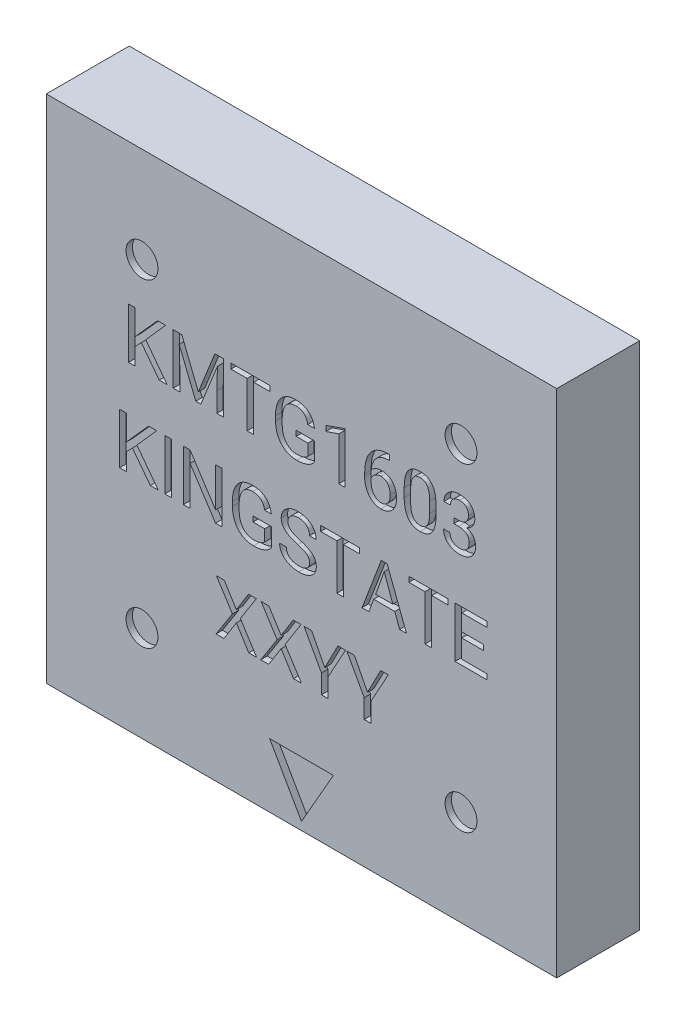
from build123d import *

# Parameters (mm, degrees)
ESQUISSE1_W             = 16
ESQUISSE1_H             = 16
BOSS_EXTRU_1_DEPTH      = 2.6
ESQUISSE2_R             = 0.5
ENL_V_MAT_EXTRU_1_DEPTH = 0.2
ESQUISSE3_W             = 0.208745941
ESQUISSE3_H             = 1.5875
ENL_V_MAT_EXTRU_2_DEPTH = 0.2


with BuildPart() as part:
    # Esquisse1 → Boss.-Extru.1 (new body)
    with BuildSketch(Plane.XY):
        with Locations((8, -8)):
            Rectangle(ESQUISSE1_W, ESQUISSE1_H)
    extrude(amount=BOSS_EXTRU_1_DEPTH)

    # Esquisse2 → Enlèv. mat.-Extru.1 (cut)
    with BuildSketch(Plane.XY.offset(2.6)):
        with Locations((3, -3)):
            Circle(ESQUISSE2_R)
        with Locations((13, -3)):
            Circle(ESQUISSE2_R)
        with Locations((13, -13)):
            Circle(ESQUISSE2_R)
        with Locations((3, -13)):
            Circle(ESQUISSE2_R)
        Polygon((7.999189106, -15.75), (8.999189106, -14), (6.999189106, -14), align=None)
    extrude(amount=-ENL_V_MAT_EXTRU_1_DEPTH, mode=Mode.SUBTRACT)

    # Esquisse3 → Enlèv. mat.-Extru.2 (cut)
    # profile 1 of 21: a face of its own
    with BuildSketch(Plane.XY.offset(2.6)):
        Polygon((13.707010958, -8.257792208), (13.020855317, -8.257792208), (13.020855317, -8.835064935), (13.817826705, -8.835064935), (13.817826705, -9), (12.812109375, -9), (12.812109375, -7.4125), (13.807196124, -7.4125), (13.807196124, -7.577435065), (13.020855317, -7.577435065), (13.020855317, -8.092857143), (13.707010958, -8.092857143), align=None)
    # profile 2 of 21: a face of its own
    with BuildSketch(Plane.XY.offset(2.6)):
        Polygon((12.586612216, -7.577435065), (12.077632914, -7.577435065), (12.077632914, -9), (11.870175528, -9), (11.870175528, -7.577435065), (11.362162642, -7.577435065), (11.362162642, -7.4125), (12.586612216, -7.4125), align=None)
    # profile 3 of 21: a face of its own
    with BuildSketch(Plane.XY.offset(2.6)):
        Polygon((10.923731737, -8.587662338), (10.26044795, -8.587662338), (10.111619825, -9), (9.896431108, -9), (10.500763494, -7.4125), (10.683416193, -7.4125), (11.289037135, -9), (11.074814834, -9), align=None)
        Polygon((10.323587155, -8.422727273), (10.861881088, -8.422727273), (10.592250913, -7.670855317), align=None, mode=Mode.SUBTRACT)
    # profile 4 of 21: a face of its own
    with BuildSketch(Plane.XY.offset(2.6)):
        Polygon((9.823949878, -7.577435065), (9.314970576, -7.577435065), (9.314970576, -9), (9.10751319, -9), (9.10751319, -7.577435065), (8.599500304, -7.577435065), (8.599500304, -7.4125), (9.823949878, -7.4125), align=None)
    # profile 5 of 21: a face of its own
    with BuildSketch(Plane.XY.offset(2.6)):
        with BuildLine():
            add(Edge.make_bspline(
                [(7.876298701, -8.292261059), (7.854664188, -8.285764441), (7.812667469, -8.273153264), (7.752394587, -8.252153704), (7.696522499, -8.230357716), (7.645210961, -8.207362912), (7.598786897, -8.182593141), (7.55634426, -8.15782518), (7.518756833, -8.131282961), (7.485663476, -8.10348242), (7.456677033, -8.074324278), (7.431654956, -8.043451028), (7.410314554, -8.011048295), (7.39312072, -7.976714466), (7.379438017, -7.941052827), (7.370238488, -7.903480864), (7.364174033, -7.864443608), (7.36348261, -7.837746624), (7.363131595, -7.824193385)],
                knots=[0, 0, 0, 0, 1.442946769, 2.801035059, 4.076184517, 5.27352813, 6.39049285, 7.436375565, 8.410868717, 9.326094427, 10.194380871, 11.033255188, 11.860919352, 12.667768038, 13.481903433, 14.295489527, 15.134672321, 16, 16, 16, 16], degree=3))
            add(Edge.make_bspline(
                [(7.363131595, -7.824193385), (7.363520425, -7.808915621), (7.364286039, -7.778833399), (7.371656998, -7.734872715), (7.383230134, -7.692781547), (7.399763394, -7.652813906), (7.420756824, -7.614728787), (7.447024325, -7.579177917), (7.477274528, -7.545117769), (7.512400911, -7.513874246), (7.550964068, -7.485262708), (7.592554786, -7.459913869), (7.637425385, -7.439111937), (7.684744901, -7.421532229), (7.735098648, -7.408512672), (7.788048779, -7.398812217), (7.843845708, -7.392946394), (7.881975732, -7.39224228), (7.901425528, -7.391883117)],
                knots=[0, 0, 0, 0, 0.949123394, 1.868842894, 2.762934863, 3.658023202, 4.551541756, 5.459557031, 6.400379858, 7.378911715, 8.376299658, 9.382673259, 10.401021107, 11.446491644, 12.51683851, 13.629846909, 14.791005431, 16, 16, 16, 16], degree=3))
            add(Edge.make_bspline(
                [(7.901425528, -7.391883117), (7.927889211, -7.392561824), (7.979702015, -7.393890654), (8.055022016, -7.406148837), (8.12604863, -7.425690985), (8.191961825, -7.453437128), (8.252252064, -7.487790377), (8.306198473, -7.528276787), (8.352560816, -7.575352565), (8.391264735, -7.627946759), (8.42181642, -7.684755658), (8.444520961, -7.74441657), (8.45762521, -7.807090152), (8.459426023, -7.849690795), (8.460336343, -7.871225649)],
                knots=[0, 0, 0, 0, 1.157874431, 2.266982995, 3.331214249, 4.376333927, 5.389203378, 6.362366569, 7.319777149, 8.271341015, 9.211596087, 10.135441968, 11.0574559, 12, 12, 12, 12], degree=3))
            Line((8.460336343, -7.871225649), (8.250301847, -7.871225649))
            add(Edge.make_bspline(
                [(8.250301847, -7.871225649), (8.25013752, -7.859287408), (8.249817941, -7.836070216), (8.244926648, -7.802271308), (8.238152705, -7.770357924), (8.227950983, -7.740386084), (8.215227158, -7.712281919), (8.199176318, -7.686408029), (8.180774871, -7.662179769), (8.159088321, -7.640521971), (8.135214645, -7.620612258), (8.108631548, -7.603581149), (8.079796504, -7.589065642), (8.048673769, -7.576960198), (8.014986816, -7.56825836), (7.979195387, -7.561310889), (7.941022059, -7.557541606), (7.91485544, -7.557063545), (7.901425528, -7.556818182)],
                knots=[0, 0, 0, 0, 1.07482023, 2.090283341, 3.071654291, 4.011100091, 4.937699537, 5.845513922, 6.749400147, 7.673165639, 8.601178817, 9.545991787, 10.511053924, 11.506634652, 12.548856192, 13.642033026, 14.789782837, 16, 16, 16, 16], degree=3))
            add(Edge.make_bspline(
                [(7.901425528, -7.556818182), (7.888957318, -7.55692659), (7.864610809, -7.557138278), (7.829145388, -7.56103031), (7.795639797, -7.566045772), (7.764424744, -7.574490323), (7.735173227, -7.58414071), (7.708024515, -7.596506993), (7.683270817, -7.611475406), (7.660329177, -7.628075283), (7.639887044, -7.646782501), (7.62232205, -7.667630546), (7.607632067, -7.690238188), (7.594966847, -7.714351696), (7.585919164, -7.740483635), (7.579060763, -7.768179963), (7.574735378, -7.797642421), (7.574337088, -7.817950179), (7.574132508, -7.828381189)],
                knots=[0, 0, 0, 0, 1.241716152, 2.424682862, 3.552343531, 4.613889406, 5.642621132, 6.619453051, 7.579256212, 8.520993708, 9.437340774, 10.333406993, 11.229728757, 12.119897209, 13.040545374, 13.977467637, 14.961133287, 16, 16, 16, 16], degree=3))
            add(Edge.make_bspline(
                [(7.574132508, -7.828381189), (7.57437111, -7.836772495), (7.574841749, -7.853324267), (7.578849992, -7.877632495), (7.585210005, -7.900902316), (7.594430418, -7.923124191), (7.606107257, -7.944305001), (7.619874274, -7.964900954), (7.637042844, -7.983864292), (7.656355746, -8.002393208), (7.679064217, -8.02001486), (7.705186047, -8.036853564), (7.734702344, -8.053740129), (7.767830124, -8.070101196), (7.804775657, -8.085670068), (7.84501245, -8.101675558), (7.88909551, -8.116555713), (7.935759516, -8.130957258), (7.982832146, -8.145305653), (8.0282287, -8.160016424), (8.07087218, -8.17517422), (8.110761379, -8.190706813), (8.148160631, -8.205988277), (8.182748474, -8.221821387), (8.214594473, -8.23796018), (8.253063519, -8.258897325), (8.296086213, -8.286670743), (8.341467107, -8.323182025), (8.379482427, -8.362689736), (8.41070326, -8.404977551), (8.434647662, -8.450831891), (8.451209792, -8.500316344), (8.462061902, -8.553475081), (8.463049343, -8.590290857), (8.463557731, -8.609245637)],
                knots=[0, 0, 0, 0, 0.628745275, 1.240194059, 1.841759006, 2.4337678, 3.038984486, 3.653024503, 4.286135225, 4.952364021, 5.657715509, 6.436970535, 7.280712884, 8.205967425, 9.2048809, 10.28571615, 11.45169818, 12.691673175, 13.947023137, 15.140987995, 16.268972542, 17.339384487, 18.350004568, 19.297407454, 20.190260585, 21.026131742, 22.580248655, 24.022346325, 25.38312576, 26.67931735, 27.95036621, 29.243629624, 30.580869372, 32, 32, 32, 32], degree=3))
            add(Edge.make_bspline(
                [(8.463557731, -8.609245637), (8.463156636, -8.624412588), (8.462366927, -8.654274551), (8.455184324, -8.697894374), (8.443118633, -8.738985544), (8.42698493, -8.778010111), (8.405550341, -8.814375199), (8.379515794, -8.848574096), (8.348639584, -8.880173238), (8.313527331, -8.909361658), (8.274648065, -8.935922953), (8.231826189, -8.958211392), (8.186327576, -8.977682556), (8.137603746, -8.993517088), (8.085753144, -9.005652707), (8.030714932, -9.014155333), (7.972633877, -9.019936268), (7.932795199, -9.020386264), (7.912378247, -9.020616883)],
                knots=[0, 0, 0, 0, 0.942848476, 1.856358972, 2.739809959, 3.601872524, 4.47585665, 5.357462874, 6.269018184, 7.217338511, 8.193540532, 9.19141121, 10.214813886, 11.268707198, 12.373513087, 13.523113076, 14.730618449, 16, 16, 16, 16], degree=3))
            add(Edge.make_bspline(
                [(7.912378247, -9.020616883), (7.88559255, -9.019929261), (7.832608392, -9.018569092), (7.754716383, -9.006066018), (7.679380723, -8.986893569), (7.619276992, -8.964151168), (7.573686158, -8.942136578), (7.541293264, -8.924493343), (7.511050184, -8.905078809), (7.482648307, -8.884562014), (7.456363102, -8.862510026), (7.432114474, -8.838948685), (7.40993491, -8.813771499), (7.389567832, -8.787388454), (7.37148582, -8.759748871), (7.356153755, -8.730959252), (7.342578783, -8.701516644), (7.332329956, -8.670823919), (7.323191478, -8.639574749), (7.317693926, -8.607141851), (7.313972057, -8.573897371), (7.313459436, -8.55137879), (7.313200081, -8.539985795)],
                knots=[0, 0, 0, 0, 1.875437348, 3.709758582, 5.512552917, 7.31498618, 8.199939646, 9.058534596, 9.897491826, 10.716098565, 11.511740121, 12.299122756, 13.082578091, 13.860523725, 14.632590546, 15.39332156, 16.144205357, 16.900795953, 17.658283692, 18.422688591, 19.201978989, 20, 20, 20, 20], degree=3))
            Line((7.313200081, -8.539985795), (7.522912439, -8.539985795))
            add(Edge.make_bspline(
                [(7.522912439, -8.539985795), (7.523157835, -8.551929628), (7.52363562, -8.575184267), (7.52921868, -8.609001366), (7.536901902, -8.641013685), (7.548733722, -8.671075001), (7.564007143, -8.699022076), (7.581973236, -8.725503503), (7.604015869, -8.74936611), (7.628730044, -8.771604538), (7.656351668, -8.791533013), (7.686500576, -8.808525055), (7.71867546, -8.823234439), (7.753140375, -8.834985639), (7.789857593, -8.844407472), (7.828737491, -8.851109017), (7.869884222, -8.854971926), (7.8979811, -8.855441304), (7.912378247, -8.855681818)],
                knots=[0, 0, 0, 0, 1.013608767, 1.9734961, 2.904960116, 3.806182834, 4.708236215, 5.606545564, 6.517183783, 7.460367022, 8.42750932, 9.403985449, 10.396018541, 11.428821219, 12.493053148, 13.613359221, 14.777059221, 16, 16, 16, 16], degree=3))
            add(Edge.make_bspline(
                [(7.912378247, -8.855681818), (7.925806864, -8.855529543), (7.951846861, -8.855234261), (7.98963354, -8.852016572), (8.024902528, -8.846473455), (8.057923638, -8.839229469), (8.08849635, -8.829531206), (8.116759104, -8.81804196), (8.142463786, -8.80407898), (8.165549768, -8.787936566), (8.186474761, -8.770303188), (8.20411004, -8.75043886), (8.21949486, -8.729377474), (8.232067304, -8.706783593), (8.241963431, -8.682590707), (8.248493053, -8.656760117), (8.252837643, -8.629481653), (8.253905288, -8.601185794), (8.252716357, -8.572943393), (8.248986767, -8.545806846), (8.242300008, -8.52042682), (8.233939066, -8.496394897), (8.221968794, -8.47447377), (8.208275615, -8.453783079), (8.191075777, -8.435548258), (8.171838585, -8.417938875), (8.148704841, -8.40194782), (8.122201368, -8.385597637), (8.09116706, -8.370173014), (8.056281416, -8.354298087), (8.017231253, -8.338596351), (7.97401848, -8.322884473), (7.92670173, -8.307013093), (7.893515176, -8.297300003), (7.876298701, -8.292261059)],
                knots=[0, 0, 0, 0, 1.274731676, 2.47188592, 3.596566026, 4.662556682, 5.678218161, 6.638111757, 7.55508779, 8.448758248, 9.309066754, 10.146416499, 10.964173464, 11.781103867, 12.595166608, 13.438391695, 14.304959699, 15.213223308, 16.121486918, 16.98655437, 17.807482669, 18.610554914, 19.394967543, 20.172593202, 20.959189078, 21.767743109, 22.64474309, 23.623879884, 24.722710417, 25.931786394, 27.26268204, 28.717272089, 30.296990951, 32, 32, 32, 32], degree=3))
        make_face()
    # profile 6 of 21: a face of its own
    with BuildSketch(Plane.XY.offset(2.6)):
        with BuildLine():
            add(Edge.make_bspline(
                [(7.053878348, -8.792864752), (7.046925424, -8.802206163), (7.033112192, -8.820764551), (7.009972632, -8.846747918), (6.984884617, -8.870878589), (6.957612078, -8.893253997), (6.928374003, -8.913718974), (6.897265326, -8.93264864), (6.863955642, -8.94923932), (6.816678815, -8.969681953), (6.753110705, -8.990384198), (6.671842677, -9.007946713), (6.584704725, -9.018750127), (6.524636491, -9.019982006), (6.493678977, -9.020616883)],
                knots=[0, 0, 0, 0, 0.666654671, 1.324429164, 1.989863089, 2.658358843, 3.342511047, 4.032250957, 4.741800952, 5.471763421, 6.980829298, 8.560994629, 10.227631307, 12, 12, 12, 12], degree=3))
            add(Edge.make_bspline(
                [(6.493678977, -9.020616883), (6.477773769, -9.020435953), (6.446325933, -9.020078217), (6.39998591, -9.015231468), (6.354958779, -9.008358894), (6.311348255, -8.998122883), (6.268762207, -8.985884856), (6.227875545, -8.969876326), (6.188249469, -8.951419779), (6.150094621, -8.930289104), (6.11358265, -8.906397584), (6.079172499, -8.879969887), (6.046704043, -8.851273131), (6.016945615, -8.819801156), (5.988468783, -8.786617637), (5.962953891, -8.750336868), (5.938988331, -8.712044916), (5.917424227, -8.671323787), (5.89815892, -8.628611185), (5.881400095, -8.584059043), (5.867199432, -8.537905558), (5.855667446, -8.490000643), (5.846313244, -8.440557724), (5.839545401, -8.389370269), (5.835379871, -8.336566816), (5.83442349, -8.300751194), (5.833938718, -8.282596895)],
                knots=[0, 0, 0, 0, 1.028468929, 2.033492539, 3.011086082, 3.973281138, 4.929413913, 5.875016411, 6.810434431, 7.755705169, 8.694007586, 9.630456767, 10.560390541, 11.493872063, 12.430450059, 13.3865576, 14.359995993, 15.351314258, 16.364872086, 17.389298017, 18.428618414, 19.486689614, 20.575265115, 21.682476393, 22.825288721, 24, 24, 24, 24], degree=3))
            Line((5.833938718, -8.282596895), (5.833938718, -8.144077212))
            add(Edge.make_bspline(
                [(5.833938718, -8.144077212), (5.834414726, -8.115067795), (5.835342085, -8.058551587), (5.843067802, -7.976274519), (5.856165808, -7.899044428), (5.874536398, -7.826979644), (5.897626772, -7.759772322), (5.926248097, -7.697576182), (5.960725814, -7.640686054), (5.999508487, -7.588506838), (6.043639644, -7.542380059), (6.091722848, -7.501599945), (6.144669822, -7.46781521), (6.201546123, -7.439750416), (6.262704569, -7.418321819), (6.327982244, -7.402733339), (6.397541565, -7.393801439), (6.445332791, -7.392533388), (6.469840706, -7.391883117)],
                knots=[0, 0, 0, 0, 1.245690805, 2.426857442, 3.545141131, 4.606601346, 5.617309566, 6.593247571, 7.540735981, 8.469521899, 9.379606562, 10.276521279, 11.170681222, 12.069904848, 12.994651948, 13.947657224, 14.947533923, 16, 16, 16, 16], degree=3))
            add(Edge.make_bspline(
                [(6.469840706, -7.391883117), (6.490047147, -7.392192996), (6.529484109, -7.392797789), (6.587040042, -7.399293333), (6.641727524, -7.408650962), (6.693420548, -7.422459876), (6.741988923, -7.440648954), (6.787585098, -7.462495087), (6.830066412, -7.488459849), (6.869401184, -7.518173162), (6.905682362, -7.551292379), (6.937918315, -7.588329841), (6.966775204, -7.628355797), (6.991683579, -7.671919156), (7.012887302, -7.718773138), (7.03064639, -7.768853187), (7.044555119, -7.822228714), (7.050726965, -7.859142272), (7.053878348, -7.877990564)],
                knots=[0, 0, 0, 0, 1.152830591, 2.249982381, 3.301969253, 4.317398906, 5.2987213, 6.258152708, 7.19892266, 8.135430506, 9.068019346, 9.997440875, 10.932925336, 11.880141718, 12.856571332, 13.864593802, 14.909648377, 16, 16, 16, 16], degree=3))
            Line((7.053878348, -7.877990564), (6.845132407, -7.877990564))
            add(Edge.make_bspline(
                [(6.845132407, -7.877990564), (6.842505728, -7.864960654), (6.837386466, -7.839566033), (6.827133463, -7.802995937), (6.81443383, -7.769199993), (6.800350269, -7.737588189), (6.783900828, -7.708607987), (6.765497605, -7.682056028), (6.745140767, -7.657945088), (6.722492087, -7.636770503), (6.698070898, -7.617795426), (6.671623536, -7.601387877), (6.643046615, -7.587401522), (6.612446916, -7.576277872), (6.579916579, -7.567434927), (6.545386309, -7.561559178), (6.508915981, -7.557484751), (6.483919328, -7.557043802), (6.471129261, -7.556818182)],
                knots=[0, 0, 0, 0, 1.170358766, 2.280968624, 3.340185272, 4.347428616, 5.325666185, 6.270042455, 7.189079754, 8.098875347, 8.995452869, 9.908633258, 10.834843072, 11.79224454, 12.771761091, 13.799439198, 14.874036465, 16, 16, 16, 16], degree=3))
            add(Edge.make_bspline(
                [(6.471129261, -7.556818182), (6.454133822, -7.557188315), (6.421059453, -7.557908621), (6.373046119, -7.565321929), (6.32805276, -7.576572579), (6.286403385, -7.593336599), (6.24783675, -7.614173134), (6.212611435, -7.640064707), (6.180489994, -7.670517325), (6.151918422, -7.705906191), (6.12630462, -7.745360713), (6.104493005, -7.789231466), (6.085729235, -7.837060308), (6.070771866, -7.889203923), (6.058891244, -7.945405416), (6.050364121, -8.005783062), (6.044723698, -8.070309102), (6.044015668, -8.11475007), (6.043651075, -8.137634436)],
                knots=[0, 0, 0, 0, 0.996403845, 1.939074856, 2.843692885, 3.711768994, 4.566040913, 5.409064383, 6.269147664, 7.155705415, 8.071400456, 9.023727466, 10.02519745, 11.081862563, 12.202603029, 13.392952397, 14.657530761, 16, 16, 16, 16], degree=3))
            Line((6.043651075, -8.137634436), (6.043651075, -8.268422788))
            add(Edge.make_bspline(
                [(6.043651075, -8.268422788), (6.043990023, -8.29034377), (6.044650895, -8.333084719), (6.050712852, -8.395361396), (6.059663629, -8.454251406), (6.073439539, -8.509526332), (6.090356281, -8.56166712), (6.111276153, -8.610298998), (6.135872126, -8.655634904), (6.164497067, -8.697004744), (6.196199702, -8.734386314), (6.230826145, -8.766923379), (6.268357947, -8.794230978), (6.308356667, -8.816955639), (6.351237481, -8.83447147), (6.39681416, -8.846638127), (6.444998131, -8.854213579), (6.478080504, -8.855185631), (6.494967532, -8.855681818)],
                knots=[0, 0, 0, 0, 1.262357278, 2.461310654, 3.601245863, 4.690377131, 5.738789585, 6.755635726, 7.735521074, 8.70490591, 9.648187167, 10.554061351, 11.434925716, 12.315681491, 13.197826198, 14.095107267, 15.027639982, 16, 16, 16, 16], degree=3))
            add(Edge.make_bspline(
                [(6.494967532, -8.855681818), (6.513881638, -8.855434714), (6.550603706, -8.854954956), (6.603833587, -8.849483458), (6.653571926, -8.841818435), (6.699657594, -8.830193294), (6.742263487, -8.814979176), (6.780928546, -8.794683371), (6.816266724, -8.770439563), (6.836185044, -8.750353431), (6.846098823, -8.740356128)],
                knots=[0, 0, 0, 0, 1.192715086, 2.315677259, 3.372538739, 4.364886101, 5.309982406, 6.218943771, 7.113529779, 8, 8, 8, 8], degree=3))
            Line((6.846098823, -8.740356128), (6.846098823, -8.381493506))
            Line((6.846098823, -8.381493506), (6.479827009, -8.381493506))
            Line((6.479827009, -8.381493506), (6.479827009, -8.216558442))
            Line((6.479827009, -8.216558442), (7.053878348, -8.216558442))
            Line((7.053878348, -8.216558442), (7.053878348, -8.792864752))
        make_face()
    # profile 7 of 21: a face of its own
    with BuildSketch(Plane.XY.offset(2.6)):
        Polygon((5.51405489, -9), (5.304342532, -9), (4.507371144, -7.776516843), (4.507371144, -9), (4.297336648, -9), (4.297336648, -7.4125), (4.507371144, -7.4125), (5.306275365, -8.641137378), (5.306275365, -7.4125), (5.51405489, -7.4125), align=None)
    # profile 8 of 21: a face of its own
    with BuildSketch(Plane.XY.offset(2.6)):
        with Locations((3.819282671, -8.20625)):
            Rectangle(ESQUISSE3_W, ESQUISSE3_H)
    # profile 9 of 21: a face of its own
    with BuildSketch(Plane.XY.offset(2.6)):
        Polygon((2.699850345, -8.261980012), (2.506244927, -8.4636389), (2.506244927, -9), (2.297498985, -9), (2.297498985, -7.4125), (2.506244927, -7.4125), (2.506244927, -8.197552252), (3.209796063, -7.4125), (3.462030743, -7.4125), (2.839014306, -8.113474026), (3.51099584, -9), (3.261016132, -9), align=None)
    # profile 10 of 21: a face of its own
    with BuildSketch(Plane.XY.offset(2.6)):
        Polygon((2.978178267, -5.261980012), (2.784572849, -5.4636389), (2.784572849, -6), (2.575826907, -6), (2.575826907, -4.4125), (2.784572849, -4.4125), (2.784572849, -5.197552252), (3.488123985, -4.4125), (3.740358665, -4.4125), (3.117342228, -5.113474026), (3.789323762, -6), (3.539344054, -6), align=None)
    # profile 11 of 21: a face of its own
    with BuildSketch(Plane.XY.offset(2.6)):
        Polygon((4.247405134, -4.4125), (4.765082183, -5.70782011), (5.282437094, -4.4125), (5.553355824, -4.4125), (5.553355824, -6), (5.344609882, -6), (5.344609882, -5.381815645), (5.364260349, -4.714666193), (4.844328328, -6), (4.684547484, -6), (4.165904018, -4.717887581), (4.186520901, -5.381815645), (4.186520901, -6), (3.977774959, -6), (3.977774959, -4.4125), align=None)
    # profile 12 of 21: a face of its own
    with BuildSketch(Plane.XY.offset(2.6)):
        Polygon((7.009745333, -4.577435065), (6.500766031, -4.577435065), (6.500766031, -6), (6.293308644, -6), (6.293308644, -4.577435065), (5.785295759, -4.577435065), (5.785295759, -4.4125), (7.009745333, -4.4125), align=None)
    # profile 13 of 21: a face of its own
    with BuildSketch(Plane.XY.offset(2.6)):
        with BuildLine():
            add(Edge.make_bspline(
                [(8.404284192, -5.792864752), (8.397331268, -5.802206163), (8.383518036, -5.820764551), (8.360378476, -5.846747918), (8.335290461, -5.870878589), (8.308017922, -5.893253997), (8.278779847, -5.913718974), (8.24767117, -5.93264864), (8.214361486, -5.94923932), (8.167084659, -5.969681953), (8.103516549, -5.990384198), (8.022248522, -6.007946713), (7.935110569, -6.018750127), (7.875042335, -6.019982006), (7.844084821, -6.020616883)],
                knots=[0, 0, 0, 0, 0.666654671, 1.324429164, 1.989863089, 2.658358843, 3.342511047, 4.032250957, 4.741800952, 5.471763421, 6.980829298, 8.560994629, 10.227631307, 12, 12, 12, 12], degree=3))
            add(Edge.make_bspline(
                [(7.844084821, -6.020616883), (7.828179613, -6.020435953), (7.796731778, -6.020078217), (7.750391754, -6.015231468), (7.705364623, -6.008358894), (7.661754099, -5.998122883), (7.619168051, -5.985884856), (7.57828139, -5.969876326), (7.538655313, -5.951419779), (7.500500466, -5.930289104), (7.463988494, -5.906397584), (7.429578343, -5.879969887), (7.397109887, -5.851273131), (7.36735146, -5.819801156), (7.338874627, -5.786617637), (7.313359735, -5.750336868), (7.289394175, -5.712044916), (7.267830071, -5.671323787), (7.248564764, -5.628611185), (7.231805939, -5.584059043), (7.217605276, -5.537905558), (7.206073291, -5.490000643), (7.196719088, -5.440557724), (7.189951246, -5.389370269), (7.185785715, -5.336566816), (7.184829334, -5.300751194), (7.184344562, -5.282596895)],
                knots=[0, 0, 0, 0, 1.028468929, 2.033492539, 3.011086082, 3.973281138, 4.929413913, 5.875016411, 6.810434431, 7.755705169, 8.694007586, 9.630456767, 10.560390541, 11.493872063, 12.430450059, 13.3865576, 14.359995993, 15.351314258, 16.364872086, 17.389298017, 18.428618414, 19.486689614, 20.575265115, 21.682476393, 22.825288721, 24, 24, 24, 24], degree=3))
            Line((7.184344562, -5.282596895), (7.184344562, -5.144077212))
            add(Edge.make_bspline(
                [(7.184344562, -5.144077212), (7.18482057, -5.115067795), (7.18574793, -5.058551587), (7.193473646, -4.976274519), (7.206571652, -4.899044428), (7.224942242, -4.826979644), (7.248032616, -4.759772322), (7.276653942, -4.697576182), (7.311131658, -4.640686054), (7.349914331, -4.588506838), (7.394045488, -4.542380059), (7.442128692, -4.501599945), (7.495075666, -4.46781521), (7.551951967, -4.439750416), (7.613110413, -4.418321819), (7.678388088, -4.402733339), (7.747947409, -4.393801439), (7.795738635, -4.392533388), (7.82024655, -4.391883117)],
                knots=[0, 0, 0, 0, 1.245690805, 2.426857442, 3.545141131, 4.606601346, 5.617309566, 6.593247571, 7.540735981, 8.469521899, 9.379606562, 10.276521279, 11.170681222, 12.069904848, 12.994651948, 13.947657224, 14.947533923, 16, 16, 16, 16], degree=3))
            add(Edge.make_bspline(
                [(7.82024655, -4.391883117), (7.840452991, -4.392192996), (7.879889953, -4.392797789), (7.937445887, -4.399293333), (7.992133369, -4.408650962), (8.043826392, -4.422459876), (8.092394767, -4.440648954), (8.137990943, -4.462495087), (8.180472256, -4.488459849), (8.219807028, -4.518173162), (8.256088206, -4.551292379), (8.288324159, -4.588329841), (8.317181048, -4.628355797), (8.342089423, -4.671919156), (8.363293146, -4.718773138), (8.381052235, -4.768853187), (8.394960964, -4.822228714), (8.40113281, -4.859142272), (8.404284192, -4.877990564)],
                knots=[0, 0, 0, 0, 1.152830591, 2.249982381, 3.301969253, 4.317398906, 5.2987213, 6.258152708, 7.19892266, 8.135430506, 9.068019346, 9.997440875, 10.932925336, 11.880141718, 12.856571332, 13.864593802, 14.909648377, 16, 16, 16, 16], degree=3))
            Line((8.404284192, -4.877990564), (8.195538251, -4.877990564))
            add(Edge.make_bspline(
                [(8.195538251, -4.877990564), (8.192911572, -4.864960654), (8.187792311, -4.839566033), (8.177539308, -4.802995937), (8.164839674, -4.769199993), (8.150756113, -4.737588189), (8.134306672, -4.708607987), (8.115903449, -4.682056028), (8.095546611, -4.657945088), (8.072897931, -4.636770503), (8.048476742, -4.617795426), (8.02202938, -4.601387877), (7.993452459, -4.587401522), (7.96285276, -4.576277872), (7.930322423, -4.567434927), (7.895792154, -4.561559178), (7.859321825, -4.557484751), (7.834325172, -4.557043802), (7.821535106, -4.556818182)],
                knots=[0, 0, 0, 0, 1.170358766, 2.280968624, 3.340185272, 4.347428616, 5.325666185, 6.270042455, 7.189079754, 8.098875347, 8.995452869, 9.908633258, 10.834843072, 11.79224454, 12.771761091, 13.799439198, 14.874036465, 16, 16, 16, 16], degree=3))
            add(Edge.make_bspline(
                [(7.821535106, -4.556818182), (7.804539666, -4.557188315), (7.771465297, -4.557908621), (7.723451963, -4.565321929), (7.678458604, -4.576572579), (7.636809229, -4.593336599), (7.598242594, -4.614173134), (7.563017279, -4.640064707), (7.530895838, -4.670517325), (7.502324266, -4.705906191), (7.476710464, -4.745360713), (7.45489885, -4.789231466), (7.436135079, -4.837060308), (7.42117771, -4.889203923), (7.409297088, -4.945405416), (7.400769965, -5.005783062), (7.395129542, -5.070309102), (7.394421512, -5.11475007), (7.39405692, -5.137634436)],
                knots=[0, 0, 0, 0, 0.996403845, 1.939074856, 2.843692885, 3.711768994, 4.566040913, 5.409064383, 6.269147664, 7.155705415, 8.071400456, 9.023727466, 10.02519745, 11.081862563, 12.202603029, 13.392952397, 14.657530761, 16, 16, 16, 16], degree=3))
            Line((7.39405692, -5.137634436), (7.39405692, -5.268422788))
            add(Edge.make_bspline(
                [(7.39405692, -5.268422788), (7.394395868, -5.29034377), (7.395056739, -5.333084719), (7.401118696, -5.395361396), (7.410069473, -5.454251406), (7.423845384, -5.509526332), (7.440762125, -5.56166712), (7.461681997, -5.610298998), (7.48627797, -5.655634904), (7.514902911, -5.697004744), (7.546605546, -5.734386314), (7.581231989, -5.766923379), (7.618763791, -5.794230978), (7.658762511, -5.816955639), (7.701643325, -5.83447147), (7.747220005, -5.846638127), (7.795403975, -5.854213579), (7.828486349, -5.855185631), (7.845373377, -5.855681818)],
                knots=[0, 0, 0, 0, 1.262357278, 2.461310654, 3.601245863, 4.690377131, 5.738789585, 6.755635726, 7.735521074, 8.70490591, 9.648187167, 10.554061351, 11.434925716, 12.315681491, 13.197826198, 14.095107267, 15.027639982, 16, 16, 16, 16], degree=3))
            add(Edge.make_bspline(
                [(7.845373377, -5.855681818), (7.864287482, -5.855434714), (7.901009551, -5.854954956), (7.954239431, -5.849483458), (8.00397777, -5.841818435), (8.050063438, -5.830193294), (8.092669331, -5.814979176), (8.13133439, -5.794683371), (8.166672568, -5.770439563), (8.186590888, -5.750353431), (8.196504667, -5.740356128)],
                knots=[0, 0, 0, 0, 1.192715086, 2.315677259, 3.372538739, 4.364886101, 5.309982406, 6.218943771, 7.113529779, 8, 8, 8, 8], degree=3))
            Line((8.196504667, -5.740356128), (8.196504667, -5.381493506))
            Line((8.196504667, -5.381493506), (7.830232853, -5.381493506))
            Line((7.830232853, -5.381493506), (7.830232853, -5.216558442))
            Line((7.830232853, -5.216558442), (8.404284192, -5.216558442))
            Line((8.404284192, -5.216558442), (8.404284192, -5.792864752))
        make_face()
    # profile 14 of 21: a face of its own
    with BuildSketch(Plane.XY.offset(2.6)):
        Polygon((9.369734172, -6), (9.167753145, -6), (9.167753145, -4.645084213), (8.762180398, -4.783603896), (8.762180398, -4.618668831), (9.338486709, -4.4125), (9.369734172, -4.4125), align=None)
    # profile 15 of 21: a face of its own
    with BuildSketch(Plane.XY.offset(2.6)):
        with BuildLine():
            Line((10.755897423, -4.4125), (10.755897423, -4.577435065))
            Line((10.755897423, -4.577435065), (10.718851461, -4.577435065))
            add(Edge.make_bspline(
                [(10.718851461, -4.577435065), (10.69971468, -4.578194281), (10.662376441, -4.579675607), (10.607904521, -4.587130929), (10.556493234, -4.599079831), (10.507998108, -4.615104729), (10.462562948, -4.635534481), (10.420134351, -4.660138455), (10.380509047, -4.688954188), (10.344263856, -4.722155571), (10.311219765, -4.759048782), (10.281815556, -4.799554163), (10.25598216, -4.843439474), (10.234141016, -4.890783745), (10.215599446, -4.941256396), (10.201316988, -4.995327148), (10.190236953, -5.052697989), (10.185963052, -5.092279737), (10.183778916, -5.11250761)],
                knots=[0, 0, 0, 0, 1.091157859, 2.128984682, 3.128137495, 4.095865509, 5.035489046, 5.96242903, 6.886697945, 7.822506445, 8.758755167, 9.705072438, 10.67078548, 11.656538905, 12.673067975, 13.731640343, 14.840776551, 16, 16, 16, 16], degree=3))
            add(Edge.make_bspline(
                [(10.183778916, -5.11250761), (10.194502609, -5.10110608), (10.21573586, -5.078530693), (10.251375939, -5.049004234), (10.290216579, -5.024350801), (10.331671332, -5.004030286), (10.376162007, -4.988494314), (10.423314376, -4.977264114), (10.473394546, -4.970386302), (10.507721093, -4.969571719), (10.525246043, -4.969155844)],
                knots=[0, 0, 0, 0, 0.981677236, 1.943751893, 2.895289451, 3.862753925, 4.834667611, 5.846439526, 6.900529096, 8, 8, 8, 8], degree=3))
            add(Edge.make_bspline(
                [(10.525246043, -4.969155844), (10.542020699, -4.969569278), (10.57485302, -4.970378475), (10.622790691, -4.977292076), (10.668243628, -4.988589024), (10.711142706, -5.004225438), (10.751356698, -5.02483788), (10.788707745, -5.050125607), (10.823797605, -5.079611852), (10.855834328, -5.113443587), (10.884710565, -5.150696472), (10.910067898, -5.190889621), (10.931215454, -5.233825472), (10.948805655, -5.279286584), (10.962249519, -5.327418981), (10.971870937, -5.378280834), (10.977750476, -5.431716044), (10.978457557, -5.468241117), (10.978817472, -5.486832894)],
                knots=[0, 0, 0, 0, 1.039980532, 2.035509747, 2.996582654, 3.940543103, 4.860903185, 5.791852656, 6.732400408, 7.698077284, 8.675872521, 9.651488014, 10.640311747, 11.639642954, 12.670628428, 13.73514097, 14.847154866, 16, 16, 16, 16], degree=3))
            add(Edge.make_bspline(
                [(10.978817472, -5.486832894), (10.978527049, -5.506611104), (10.977960327, -5.545205767), (10.971207551, -5.601410907), (10.961004776, -5.654662896), (10.946702621, -5.705055922), (10.927509264, -5.752201988), (10.904579849, -5.796423397), (10.87733704, -5.83753164), (10.84621764, -5.875508509), (10.811446348, -5.90950011), (10.773947701, -5.939664915), (10.732957745, -5.964260109), (10.689668255, -5.985287044), (10.643141763, -6.000851073), (10.594132044, -6.012573955), (10.542081172, -6.019390252), (10.506474492, -6.020200857), (10.488200081, -6.020616883)],
                knots=[0, 0, 0, 0, 1.160113194, 2.263813421, 3.316767604, 4.339902053, 5.332221125, 6.299000376, 7.258523217, 8.221103713, 9.174710884, 10.107690257, 11.038219043, 11.974003353, 12.9265689, 13.910912406, 14.927817905, 16, 16, 16, 16], degree=3))
            add(Edge.make_bspline(
                [(10.488200081, -6.020616883), (10.469693895, -6.020204143), (10.433341197, -6.019393376), (10.380358547, -6.010578382), (10.329851068, -5.997297882), (10.282313629, -5.977635677), (10.237156855, -5.953069708), (10.194739022, -5.92292956), (10.155252021, -5.88709541), (10.118673692, -5.846277968), (10.08577685, -5.80109275), (10.056882628, -5.752496263), (10.032655548, -5.700689897), (10.013042455, -5.645627281), (9.997677413, -5.58752944), (9.986252462, -5.526404406), (9.979917499, -5.462055719), (9.979030091, -5.418123236), (9.978576502, -5.395667614)],
                knots=[0, 0, 0, 0, 0.98196525, 1.928927253, 2.844758948, 3.750233454, 4.653694275, 5.569898774, 6.506708913, 7.47997454, 8.475786024, 9.47047009, 10.478212746, 11.508236057, 12.570636359, 13.666817008, 14.807418256, 16, 16, 16, 16], degree=3))
            Line((9.978576502, -5.395667614), (9.978576502, -5.318354302))
            add(Edge.make_bspline(
                [(9.978576502, -5.318354302), (9.97909135, -5.282899185), (9.98008994, -5.214131077), (9.988978422, -5.114170968), (10.003093545, -5.020537699), (10.023722318, -4.933413896), (10.049794775, -4.852632209), (10.081415812, -4.778131116), (10.119857412, -4.710459294), (10.163241221, -4.648670158), (10.213024247, -4.594007115), (10.268725668, -4.546499568), (10.329953693, -4.506038201), (10.39691017, -4.472653117), (10.469592413, -4.44654801), (10.548011067, -4.427724919), (10.632048065, -4.415640509), (10.690032056, -4.413565772), (10.719817877, -4.4125)],
                knots=[0, 0, 0, 0, 1.277596776, 2.478003778, 3.613754522, 4.687626462, 5.700978049, 6.670049158, 7.598905399, 8.500929788, 9.385788113, 10.255968039, 11.132911756, 12.024246098, 12.94607771, 13.910066108, 14.926420989, 16, 16, 16, 16], degree=3))
            Line((10.719817877, -4.4125), (10.755897423, -4.4125))
        make_face()
        with BuildLine():
            add(Edge.make_bspline(
                [(10.491743608, -5.134090909), (10.474812505, -5.134807729), (10.441189641, -5.136231237), (10.392021214, -5.14851797), (10.34466604, -5.167464505), (10.300728956, -5.194719669), (10.260899999, -5.227035865), (10.226641184, -5.263852184), (10.199507755, -5.305117119), (10.186874042, -5.335203613), (10.180557528, -5.350246043)],
                knots=[0, 0, 0, 0, 1.008444552, 2.002633596, 3.005224358, 4.039908368, 5.073184091, 6.056754431, 7.028429986, 8, 8, 8, 8], degree=3))
            Line((10.180557528, -5.350246043), (10.180557528, -5.423693689))
            add(Edge.make_bspline(
                [(10.180557528, -5.423693689), (10.18076247, -5.439489161), (10.181163363, -5.470387065), (10.185526358, -5.515462308), (10.192132225, -5.558236386), (10.201776195, -5.598657507), (10.214407028, -5.636752137), (10.229464302, -5.672590373), (10.2472923, -5.706062541), (10.267719554, -5.736882863), (10.290598781, -5.764323992), (10.314480238, -5.788876552), (10.340000632, -5.80968734), (10.367130312, -5.826458765), (10.39549744, -5.839494873), (10.425091427, -5.849007207), (10.456210992, -5.854514108), (10.477440885, -5.855289071), (10.488200081, -5.855681818)],
                knots=[0, 0, 0, 0, 1.283539721, 2.51076306, 3.677392053, 4.799415647, 5.884154539, 6.936271597, 7.955432841, 8.96248719, 9.935882104, 10.855510359, 11.742928931, 12.605224519, 13.441005033, 14.274640703, 15.125597116, 16, 16, 16, 16], degree=3))
            add(Edge.make_bspline(
                [(10.488200081, -5.855681818), (10.49927502, -5.855359031), (10.520875434, -5.854729472), (10.552334571, -5.850218542), (10.58196732, -5.842466929), (10.609712448, -5.831447895), (10.6357882, -5.817581689), (10.659819658, -5.800229105), (10.682071034, -5.779893077), (10.702343047, -5.756554129), (10.72062085, -5.730910629), (10.736620106, -5.703007907), (10.749481158, -5.672888863), (10.761154923, -5.641336849), (10.769229934, -5.607556522), (10.7754695, -5.572072493), (10.77894069, -5.534577889), (10.779466618, -5.508959621), (10.779735694, -5.49585278)],
                knots=[0, 0, 0, 0, 1.01911688, 1.987672023, 2.917749205, 3.831672007, 4.729258522, 5.628801512, 6.552186455, 7.497677453, 8.468448512, 9.446636265, 10.451080494, 11.479498908, 12.538931857, 13.642126426, 14.793662575, 16, 16, 16, 16], degree=3))
            add(Edge.make_bspline(
                [(10.779735694, -5.49585278), (10.77947392, -5.482637485), (10.778964295, -5.45690969), (10.775411301, -5.419215935), (10.769338389, -5.383452908), (10.760770651, -5.349554387), (10.749236736, -5.317776831), (10.735981237, -5.287699744), (10.719514806, -5.259884079), (10.701437522, -5.233732538), (10.680854235, -5.210462062), (10.658880712, -5.189698028), (10.634807714, -5.172815131), (10.609608467, -5.158121384), (10.582147385, -5.147845772), (10.553586432, -5.139488731), (10.523126841, -5.135067052), (10.502386433, -5.134421943), (10.491743608, -5.134090909)],
                knots=[0, 0, 0, 0, 1.221889355, 2.378798227, 3.496925182, 4.573365822, 5.606582527, 6.619759187, 7.607463809, 8.590867301, 9.554780489, 10.475165735, 11.378905723, 12.268074956, 13.164146708, 14.082011448, 15.015794874, 16, 16, 16, 16], degree=3))
        make_face(mode=Mode.SUBTRACT)
    # profile 16 of 21: a face of its own
    with BuildSketch(Plane.XY.offset(2.6)):
        with BuildLine():
            add(Edge.make_bspline(
                [(12.216796875, -5.322864245), (12.216409507, -5.351434568), (12.215660229, -5.406697603), (12.210389984, -5.486747553), (12.200667479, -5.561052688), (12.18761056, -5.629727362), (12.171119538, -5.693003687), (12.150131156, -5.75041047), (12.125799661, -5.802398622), (12.09729288, -5.848594236), (12.064796447, -5.889320639), (12.028287501, -5.924936415), (11.986781515, -5.954346126), (11.941314927, -5.978656221), (11.891667071, -5.997757863), (11.837793549, -6.011139163), (11.779693121, -6.019346504), (11.73952298, -6.020184143), (11.718770292, -6.020616883)],
                knots=[0, 0, 0, 0, 1.40023343, 2.708445015, 3.929118437, 5.070650633, 6.132737954, 7.130001643, 8.062197437, 8.941367129, 9.783809667, 10.610069827, 11.432297786, 12.268139301, 13.131125304, 14.032261292, 14.983427318, 16, 16, 16, 16], degree=3))
            add(Edge.make_bspline(
                [(11.718770292, -6.020616883), (11.698334152, -6.020202543), (11.658688192, -6.019398727), (11.601357996, -6.010893413), (11.547748227, -5.998554121), (11.498608189, -5.979500783), (11.453203554, -5.956084086), (11.412334907, -5.926644928), (11.375314638, -5.892329125), (11.34250322, -5.852506531), (11.313933751, -5.807474707), (11.288991976, -5.75735045), (11.267905333, -5.702058058), (11.25017178, -5.6416478), (11.236533279, -5.576009676), (11.226348631, -5.50521976), (11.219472181, -5.429298492), (11.218184785, -5.376891355), (11.217522321, -5.349923904)],
                knots=[0, 0, 0, 0, 1.02805657, 1.994422029, 2.912254547, 3.791761639, 4.640526213, 5.477606564, 6.319143947, 7.175364868, 8.067638948, 8.998434952, 9.989333135, 11.043079992, 12.164854869, 13.361348356, 14.642213427, 16, 16, 16, 16], degree=3))
            Line((11.217522321, -5.349923904), (11.217522321, -5.080938007))
            add(Edge.make_bspline(
                [(11.217522321, -5.080938007), (11.217910515, -5.052690004), (11.21866111, -4.998070911), (11.223914735, -4.918981454), (11.233699837, -4.845548342), (11.246615104, -4.777693053), (11.263357024, -4.715282082), (11.283781913, -4.658467615), (11.308199066, -4.607170682), (11.33683015, -4.561625884), (11.369085833, -4.5211027), (11.406157504, -4.486385009), (11.447525277, -4.457153152), (11.493110321, -4.433135267), (11.543000012, -4.41440879), (11.597218719, -4.401447977), (11.655481959, -4.393144601), (11.69576123, -4.392312078), (11.716515321, -4.391883117)],
                knots=[0, 0, 0, 0, 1.393495682, 2.694401802, 3.907295328, 5.045885101, 6.099565595, 7.091578124, 8.02030673, 8.89623373, 9.740051124, 10.568244803, 11.392771337, 12.231586015, 13.103274323, 14.014157231, 14.976784819, 16, 16, 16, 16], degree=3))
            add(Edge.make_bspline(
                [(11.716515321, -4.391883117), (11.737157573, -4.392341396), (11.777093342, -4.39322801), (11.834955259, -4.401088622), (11.888584528, -4.413949888), (11.938364842, -4.431399228), (11.983444897, -4.454949049), (12.024654596, -4.483181092), (12.061439851, -4.516847171), (12.094077661, -4.555773158), (12.122425218, -4.600074324), (12.147311311, -4.649604014), (12.168052173, -4.70475489), (12.185511053, -4.76526458), (12.198792364, -4.831560923), (12.208571458, -4.903324367), (12.215193732, -4.980633747), (12.216250242, -5.033998849), (12.216796875, -5.061609679)],
                knots=[0, 0, 0, 0, 1.036707429, 2.005677803, 2.926853111, 3.803974618, 4.648486318, 5.474530802, 6.30701549, 7.145578633, 8.019475601, 8.943521554, 9.925396686, 10.975451482, 12.10436541, 13.318982711, 14.612855355, 16, 16, 16, 16], degree=3))
            Line((12.216796875, -5.061609679), (12.216796875, -5.322864245))
        make_face()
        with BuildLine():
            add(Edge.make_bspline(
                [(12.015460126, -5.046791295), (12.015358743, -5.026166864), (12.015163202, -4.986387731), (12.011313036, -4.928914779), (12.006271575, -4.875732751), (11.998040597, -4.826951505), (11.988234497, -4.7823489), (11.976244806, -4.741902757), (11.961337008, -4.706075972), (11.944620357, -4.674225436), (11.925056643, -4.646667498), (11.903356689, -4.622371687), (11.878725552, -4.601933397), (11.851291974, -4.585423036), (11.821351167, -4.572292664), (11.788641725, -4.563556658), (11.753436061, -4.557873535), (11.729102439, -4.557177976), (11.716515321, -4.556818182)],
                knots=[0, 0, 0, 0, 1.517926963, 2.927684219, 4.238898001, 5.448787502, 6.566849578, 7.599612596, 8.549419051, 9.419425551, 10.241877608, 11.030983508, 11.81133014, 12.588145411, 13.381161416, 14.209669346, 15.073910809, 16, 16, 16, 16], degree=3))
            add(Edge.make_bspline(
                [(11.716515321, -4.556818182), (11.704036211, -4.557179957), (11.679917383, -4.557879174), (11.645020083, -4.563532087), (11.61271136, -4.572365595), (11.582896843, -4.585128777), (11.555601946, -4.601508513), (11.531407333, -4.622173464), (11.509436219, -4.645921397), (11.490465718, -4.673574107), (11.47398088, -4.705016806), (11.459515742, -4.740168485), (11.44752359, -4.779274982), (11.437038856, -4.822150044), (11.429243598, -4.869002505), (11.423467913, -4.919752155), (11.420003345, -4.97437173), (11.419249583, -5.012102847), (11.418859071, -5.031650771)],
                knots=[0, 0, 0, 0, 0.941965402, 1.82057074, 2.66271545, 3.46560191, 4.262527736, 5.056849829, 5.860391306, 6.699484899, 7.581041908, 8.537350148, 9.565857304, 10.667324152, 11.868550899, 13.150090833, 14.523504931, 16, 16, 16, 16], degree=3))
            Line((11.418859071, -5.031650771), (11.418859071, -5.35378957))
            add(Edge.make_bspline(
                [(11.418859071, -5.35378957), (11.41914919, -5.374517622), (11.419710246, -5.41460319), (11.422791446, -5.472662789), (11.428394849, -5.526469175), (11.436978959, -5.575979259), (11.446936999, -5.621525272), (11.459775371, -5.662801478), (11.474974418, -5.699892873), (11.492268587, -5.732921164), (11.512017682, -5.76203558), (11.534516239, -5.787078152), (11.559268445, -5.80856488), (11.586800515, -5.825672376), (11.616220491, -5.839513463), (11.648327733, -5.848643998), (11.682676735, -5.854693652), (11.706501217, -5.855345916), (11.718770292, -5.855681818)],
                knots=[0, 0, 0, 0, 1.50665053, 2.913681466, 4.224632892, 5.435887079, 6.564349371, 7.611008132, 8.573407165, 9.474177506, 10.316300961, 11.123258751, 11.914782798, 12.689976991, 13.472211437, 14.26986845, 15.109020931, 16, 16, 16, 16], degree=3))
            add(Edge.make_bspline(
                [(11.718770292, -5.855681818), (11.730814319, -5.855277333), (11.754157461, -5.854493379), (11.788052931, -5.849388012), (11.81961567, -5.840389206), (11.848654503, -5.827375327), (11.875432814, -5.811216346), (11.899612599, -5.791232256), (11.92121486, -5.767473148), (11.940691744, -5.740127734), (11.957843665, -5.70887896), (11.972482919, -5.673470352), (11.985434027, -5.634222719), (11.995539522, -5.590614742), (12.003762978, -5.543065421), (12.010356607, -5.491277419), (12.013958733, -5.435337756), (12.014948964, -5.396638261), (12.015460126, -5.376661425)],
                knots=[0, 0, 0, 0, 0.907615006, 1.759094876, 2.576076633, 3.37305625, 4.150235137, 4.926275732, 5.728088303, 6.563419022, 7.45078728, 8.408155106, 9.447100327, 10.561932391, 11.777903666, 13.082715903, 14.49408613, 16, 16, 16, 16], degree=3))
            Line((12.015460126, -5.376661425), (12.015460126, -5.046791295))
        make_face(mode=Mode.SUBTRACT)
    # profile 17 of 21: a face of its own
    with BuildSketch(Plane.XY.offset(2.6)):
        with BuildLine():
            Line((12.774096997, -5.113474026), (12.925180093, -5.113474026))
            add(Edge.make_bspline(
                [(12.925180093, -5.113474026), (12.936788331, -5.113110199), (12.959423703, -5.112400757), (12.99237866, -5.108471396), (13.023421659, -5.102420096), (13.052540531, -5.094048932), (13.079762706, -5.083444534), (13.104918087, -5.070443866), (13.128454969, -5.055657033), (13.149631511, -5.038205738), (13.168644539, -5.018802702), (13.185489127, -4.998000639), (13.199478448, -4.975311205), (13.211220684, -4.951224745), (13.219745242, -4.925143426), (13.226273024, -4.897690338), (13.230187197, -4.868545705), (13.230652034, -4.848580409), (13.230889813, -4.838367492)],
                knots=[0, 0, 0, 0, 1.200864367, 2.341614004, 3.428590173, 4.469117729, 5.471540268, 6.4451815, 7.394182585, 8.341361919, 9.276019593, 10.200591215, 11.103629179, 12.027666906, 12.965487114, 13.935383191, 14.943879401, 16, 16, 16, 16], degree=3))
            add(Edge.make_bspline(
                [(13.230889813, -4.838367492), (13.230741844, -4.826976879), (13.230455029, -4.804898008), (13.227180965, -4.772906983), (13.221830073, -4.743129638), (13.213969711, -4.715584651), (13.204442072, -4.690021857), (13.192619154, -4.66664578), (13.178012697, -4.645886716), (13.162163312, -4.62666774), (13.143485815, -4.610112403), (13.12261504, -4.595916873), (13.099816879, -4.583567207), (13.074606156, -4.574027578), (13.047484924, -4.5661757), (13.018001487, -4.560951673), (12.986485136, -4.557148036), (12.964708335, -4.556930079), (12.953528308, -4.556818182)],
                knots=[0, 0, 0, 0, 1.205200971, 2.336088131, 3.399393991, 4.403211767, 5.363627486, 6.283652907, 7.166347384, 8.045302391, 8.914578364, 9.797272842, 10.712512295, 11.651712761, 12.644597703, 13.696729519, 14.817520295, 16, 16, 16, 16], degree=3))
            add(Edge.make_bspline(
                [(12.953528308, -4.556818182), (12.942893612, -4.55712156), (12.922219351, -4.55771134), (12.891845852, -4.560685633), (12.863388186, -4.567053737), (12.836267066, -4.574866698), (12.811205666, -4.58577464), (12.78723055, -4.598146277), (12.765539519, -4.613891191), (12.745126318, -4.631089482), (12.727076745, -4.65053788), (12.711318616, -4.671542061), (12.697479762, -4.693923082), (12.686642019, -4.718127612), (12.678312306, -4.743757976), (12.672035837, -4.770784527), (12.668601113, -4.799407242), (12.668064502, -4.819030723), (12.667791193, -4.829025467)],
                knots=[0, 0, 0, 0, 1.147390074, 2.230570743, 3.284446238, 4.288269575, 5.26905072, 6.22749524, 7.191381151, 8.152271132, 9.102706813, 10.045350165, 10.980781579, 11.934386679, 12.897507077, 13.883538365, 14.922031733, 16, 16, 16, 16], degree=3))
            Line((12.667791193, -4.829025467), (12.466454444, -4.829025467))
            add(Edge.make_bspline(
                [(12.466454444, -4.829025467), (12.466895961, -4.813646981), (12.467764442, -4.783396901), (12.474361072, -4.739137824), (12.48497687, -4.696767775), (12.500140901, -4.65646714), (12.519687189, -4.618185461), (12.543211974, -4.581819698), (12.571691045, -4.547921361), (12.603644736, -4.515954323), (12.638796481, -4.486591668), (12.677178399, -4.461568329), (12.717420646, -4.439683292), (12.760338524, -4.422466065), (12.805179553, -4.408360089), (12.852590559, -4.398882065), (12.902262667, -4.392933477), (12.936222664, -4.392237685), (12.953528308, -4.391883117)],
                knots=[0, 0, 0, 0, 1.008024764, 1.982824013, 2.927143535, 3.867385949, 4.799420644, 5.740690574, 6.700758299, 7.696462765, 8.701606573, 9.69751016, 10.696048351, 11.700180637, 12.724595536, 13.774013249, 14.865661413, 16, 16, 16, 16], degree=3))
            add(Edge.make_bspline(
                [(12.953528308, -4.391883117), (12.971688993, -4.39226601), (13.007129118, -4.393013218), (13.058750146, -4.39847509), (13.107394951, -4.407732181), (13.152956808, -4.421043086), (13.195741751, -4.437608671), (13.235227015, -4.458498975), (13.271965313, -4.48258234), (13.305077998, -4.510876944), (13.335311717, -4.541944197), (13.36097344, -4.576729325), (13.383195436, -4.61393786), (13.400941682, -4.654342984), (13.414704598, -4.697563625), (13.424665751, -4.743722923), (13.430937608, -4.792665573), (13.431577434, -4.826321528), (13.431904424, -4.843521713)],
                knots=[0, 0, 0, 0, 1.168106029, 2.279529761, 3.334843901, 4.349144189, 5.329135759, 6.280770157, 7.217598711, 8.14891045, 9.077143126, 9.99998857, 10.922834015, 11.85984081, 12.831937471, 13.835906664, 14.894020291, 16, 16, 16, 16], degree=3))
            add(Edge.make_bspline(
                [(13.431904424, -4.843521713), (13.431089996, -4.860777247), (13.429449903, -4.895526399), (13.416204037, -4.946959517), (13.394893681, -4.997432042), (13.365716512, -5.04619002), (13.329681553, -5.091863853), (13.286728134, -5.131725184), (13.237722613, -5.165664397), (13.201431903, -5.182505452), (13.182891132, -5.191109476)],
                knots=[0, 0, 0, 0, 0.915149848, 1.842926455, 2.801118709, 3.815975001, 4.850543085, 5.879125129, 6.91645399, 8, 8, 8, 8], degree=3))
            add(Edge.make_bspline(
                [(13.182891132, -5.191109476), (13.193453336, -5.194760882), (13.214251318, -5.201950845), (13.244320439, -5.214415221), (13.272476117, -5.228915408), (13.298472229, -5.245452861), (13.322966044, -5.263225626), (13.345458046, -5.282879811), (13.366165585, -5.304198034), (13.384906671, -5.327161815), (13.401656208, -5.351597633), (13.416203416, -5.37747151), (13.428486621, -5.404637102), (13.438473109, -5.433096658), (13.446294793, -5.462934946), (13.451508381, -5.494106903), (13.455412889, -5.526573234), (13.455631189, -5.54867099), (13.455742695, -5.559958401)],
                knots=[0, 0, 0, 0, 1.083547811, 2.133608447, 3.153499447, 4.150164076, 5.118580075, 6.085371355, 7.042639587, 7.997242512, 8.956095064, 9.91183307, 10.871815678, 11.843305578, 12.833312241, 13.858716205, 14.906244142, 16, 16, 16, 16], degree=3))
            add(Edge.make_bspline(
                [(13.455742695, -5.559958401), (13.455295441, -5.577157691), (13.454420043, -5.610821391), (13.447995277, -5.659957152), (13.436928496, -5.706315275), (13.421951283, -5.750090894), (13.402001132, -5.790908501), (13.378202481, -5.829257016), (13.349468102, -5.864453603), (13.317111854, -5.897006944), (13.280876273, -5.925778664), (13.24220301, -5.951586712), (13.200429955, -5.972686956), (13.156209983, -5.990202863), (13.1095713, -6.004097686), (13.060151006, -6.013692565), (13.008223249, -6.01940458), (12.954490972, -6.021262892), (12.900899271, -6.019303749), (12.84892094, -6.014102059), (12.799620172, -6.004286333), (12.752816815, -5.991181386), (12.708482193, -5.974392936), (12.667006065, -5.953414395), (12.627953273, -5.928705279), (12.591823861, -5.900533156), (12.558883152, -5.869458008), (12.53029206, -5.835435586), (12.506391929, -5.79877103), (12.486633755, -5.75988935), (12.470973136, -5.71868199), (12.46013111, -5.674992822), (12.453576648, -5.628880136), (12.452719025, -5.59734851), (12.452280337, -5.581219562)],
                knots=[0, 0, 0, 0, 1.088231885, 2.129966551, 3.128731662, 4.100052983, 5.051273094, 5.997700031, 6.949599447, 7.920159917, 8.89645961, 9.872688362, 10.857299744, 11.851593804, 12.87927234, 13.932029094, 15.03283187, 16.181901815, 17.330971759, 18.424283131, 19.483707051, 20.507604696, 21.496964264, 22.478499351, 23.443669235, 24.416866361, 25.373314325, 26.304222394, 27.222043756, 28.136740867, 29.059278814, 30.005242181, 30.979648351, 32, 32, 32, 32], degree=3))
            Line((12.452280337, -5.581219562), (12.654583502, -5.581219562))
            add(Edge.make_bspline(
                [(12.654583502, -5.581219562), (12.654824179, -5.591325301), (12.655297119, -5.611183549), (12.65921424, -5.640215395), (12.665654987, -5.667591507), (12.674392369, -5.693593127), (12.685995261, -5.717823507), (12.699872372, -5.740824184), (12.71695301, -5.761640599), (12.735699212, -5.78142366), (12.757094387, -5.798666243), (12.780099275, -5.814025248), (12.805009397, -5.826813001), (12.83156845, -5.837640516), (12.860039831, -5.845521216), (12.8900935, -5.851306905), (12.921871729, -5.854925002), (12.943639642, -5.855425055), (12.954816863, -5.855681818)],
                knots=[0, 0, 0, 0, 1.05674494, 2.076553062, 3.057328087, 3.995032292, 4.939572828, 5.862291244, 6.797233428, 7.750415868, 8.708219346, 9.664572903, 10.639154313, 11.631946583, 12.659457059, 13.723399929, 14.831028831, 16, 16, 16, 16], degree=3))
            add(Edge.make_bspline(
                [(12.954816863, -5.855681818), (12.966638981, -5.855429171), (12.989586495, -5.854938765), (13.022853693, -5.851311036), (13.054075673, -5.845703526), (13.082958483, -5.837133539), (13.110142473, -5.827155003), (13.134553335, -5.813547504), (13.157446511, -5.798582838), (13.17778096, -5.780672699), (13.195837477, -5.760605976), (13.211767138, -5.738657003), (13.225030609, -5.714478201), (13.23602028, -5.688374301), (13.244322036, -5.660033657), (13.25045605, -5.629762676), (13.253944504, -5.597407636), (13.254462321, -5.575214461), (13.254728084, -5.563824067)],
                knots=[0, 0, 0, 0, 1.188806913, 2.307553055, 3.362439901, 4.374205705, 5.33493774, 6.267577145, 7.17819455, 8.081416542, 8.983734085, 9.888955571, 10.80264205, 11.751401118, 12.732080443, 13.767830063, 14.854364266, 16, 16, 16, 16], degree=3))
            add(Edge.make_bspline(
                [(13.254728084, -5.563824067), (13.254486133, -5.552753877), (13.254014759, -5.531186803), (13.250195181, -5.499758109), (13.243372735, -5.47032361), (13.234127786, -5.442838641), (13.222087041, -5.417450997), (13.207500617, -5.394097901), (13.190304085, -5.372583796), (13.170286, -5.353334844), (13.147769881, -5.336126946), (13.1230338, -5.320905516), (13.095637206, -5.308490633), (13.066188768, -5.297699868), (13.03423531, -5.289457561), (12.999988069, -5.283393092), (12.963387407, -5.279466985), (12.938183144, -5.278769123), (12.925180093, -5.278409091)],
                knots=[0, 0, 0, 0, 1.072612395, 2.089676274, 3.061497505, 3.996058069, 4.894404615, 5.777923536, 6.658742059, 7.556546034, 8.461916413, 9.40063882, 10.364348113, 11.371623304, 12.436739071, 13.557340496, 14.739815359, 16, 16, 16, 16], degree=3))
            Line((12.925180093, -5.278409091), (12.774096997, -5.278409091))
            Line((12.774096997, -5.278409091), (12.774096997, -5.113474026))
        make_face()
    # profile 18 of 21: a face of its own
    with BuildSketch(Plane.XY.offset(2.6)):
        Polygon((5.958284294, -11.021020191), (6.33744166, -10.4125), (6.583233563, -10.4125), (6.083274148, -11.199807224), (6.595152699, -12), (6.347427963, -12), (5.958284294, -11.380849229), (5.566885653, -12), (5.319805195, -12), (5.832972301, -11.199807224), (5.332046469, -10.4125), (5.576549817, -10.4125), align=None)
    # profile 19 of 21: a face of its own
    with BuildSketch(Plane.XY.offset(2.6)):
        Polygon((7.360232346, -11.021020191), (7.739389712, -10.4125), (7.985181615, -10.4125), (7.4852222, -11.199807224), (7.997100751, -12), (7.749376015, -12), (7.360232346, -11.380849229), (6.968833705, -12), (6.721753247, -12), (7.234920353, -11.199807224), (6.733994521, -10.4125), (6.978497869, -10.4125), align=None)
    # profile 20 of 21: a face of its own
    with BuildSketch(Plane.XY.offset(2.6)):
        Polygon((8.728355824, -11.209471388), (9.141337764, -10.4125), (9.37843192, -10.4125), (8.832728795, -11.407908888), (8.832728795, -12), (8.623982853, -12), (8.623982853, -11.407908888), (8.078279728, -10.4125), (8.317306717, -10.4125), align=None)
    # profile 21 of 21: a face of its own
    with BuildSketch(Plane.XY.offset(2.6)):
        Polygon((10.068453226, -11.209471388), (10.481435166, -10.4125), (10.718529322, -10.4125), (10.172826197, -11.407908888), (10.172826197, -12), (9.964080256, -12), (9.964080256, -11.407908888), (9.418377131, -10.4125), (9.657404119, -10.4125), align=None)
    extrude(amount=-ENL_V_MAT_EXTRU_2_DEPTH, mode=Mode.SUBTRACT)


solid = part.part
